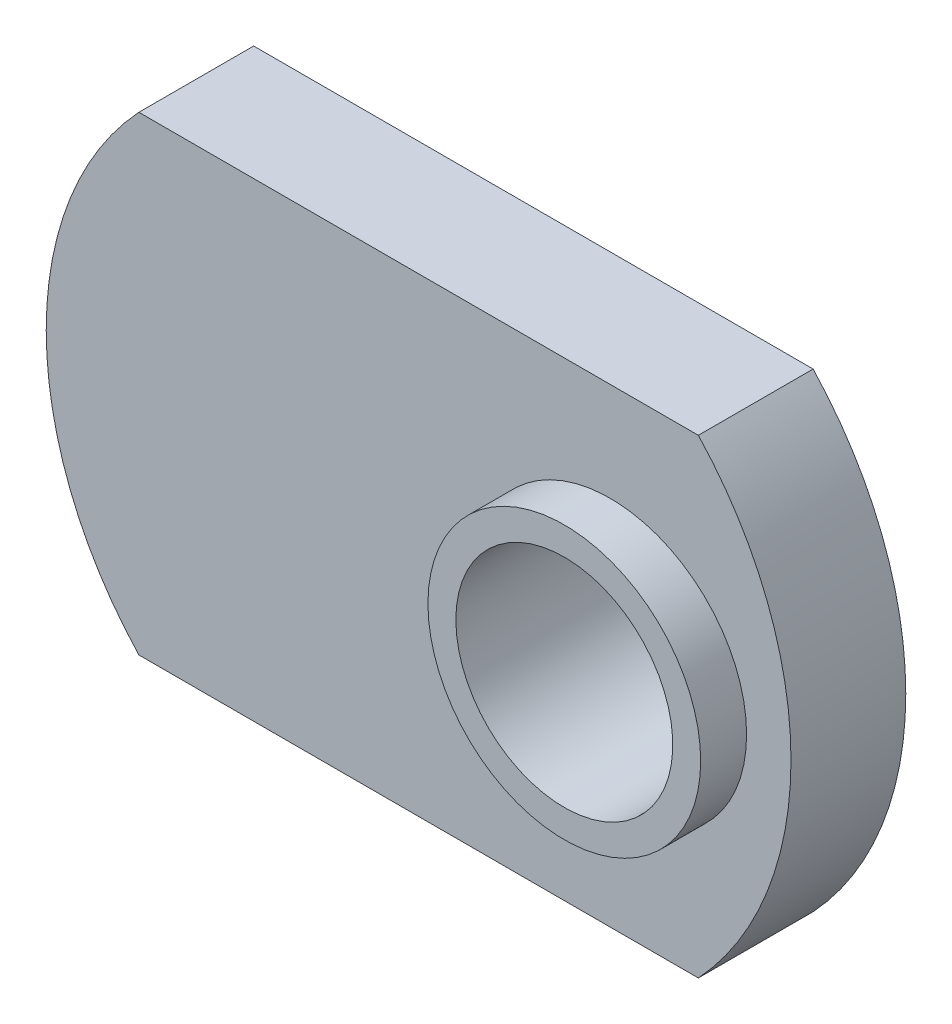
from build123d import *

# Parameters (mm, degrees)
EXTRUDE1_DEPTH     = 3.175
SKETCH4_R          = 3.772
EXTRUDE3_DEPTH     = 1.27
SKETCH6_R          = 3
CUT_EXTRUDE1_DEPTH = 181.936091825


with BuildPart() as part:
    # Sketch1 → Extrude1 (new body)
    with BuildSketch(Plane.XY):
        with BuildLine():
            Line((104.316218765, 133.220465896), (119.791106556, 133.220465896))
            ThreePointArc((119.791106556, 133.220465896), (122.35366266, 126.720465896), (119.791106556, 120.220465896))
            Line((119.791106556, 120.220465896), (104.316218765, 120.220465896))
            ThreePointArc((104.316218765, 120.220465896), (101.75366266, 126.720465896), (104.316218765, 133.220465896))
        make_face()
    extrude(amount=EXTRUDE1_DEPTH)

    # Sketch4 → Extrude3 (add)
    with BuildSketch(Plane.XY.offset(3.175)):
        with Locations((117.35366266, 126.720465896)):
            Circle(SKETCH4_R)
    extrude(amount=EXTRUDE3_DEPTH)

    # Sketch6 → Cut-Extrude1 (cut, through all)
    with BuildSketch(Plane(origin=(0, 0, 0), x_dir=(-1, 0, 0), z_dir=(0, 0, -1))):
        with Locations((-117.35366266, 126.720465896)):
            Circle(SKETCH6_R)
    extrude(amount=-CUT_EXTRUDE1_DEPTH, mode=Mode.SUBTRACT)


solid = part.part
